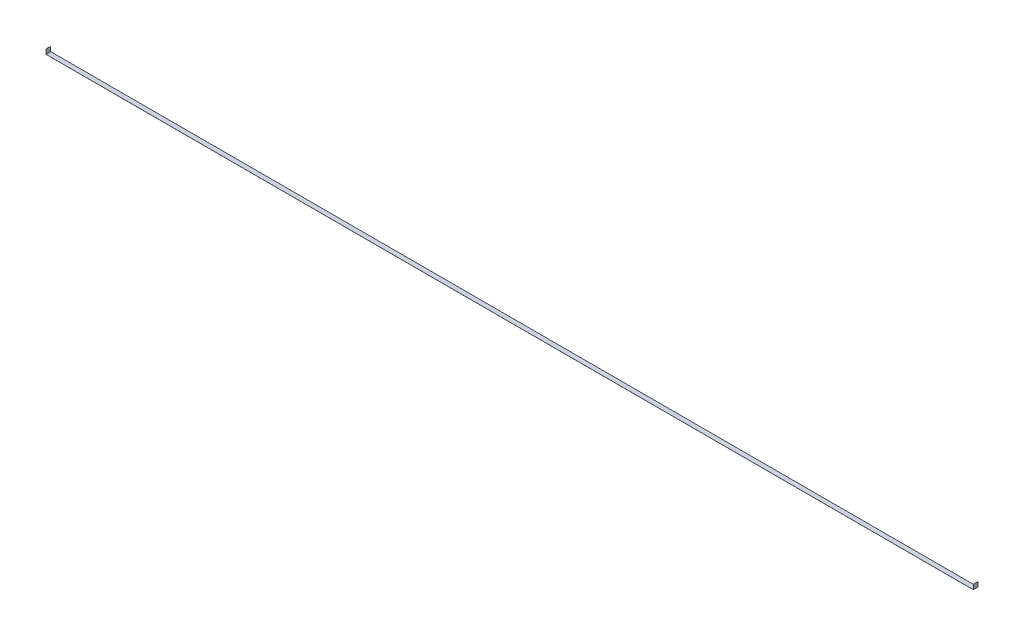
from build123d import *

# Parameters (mm, degrees)
EXTRUDE_THIN1_DEPTH = 25.4


with BuildPart() as part:
    # Sketch1 → Extrude-Thin1 (new body)
    with BuildSketch(Plane.XY):
        Polygon((-2527.3, 25.4), (-2527.3, 0), (2527.3, 0), (2527.3, 25.4), (2527.554, 25.4), (2527.554, -0.254), (-2527.554, -0.254), (-2527.554, 25.4), align=None)
    extrude(amount=EXTRUDE_THIN1_DEPTH)


solid = part.part
